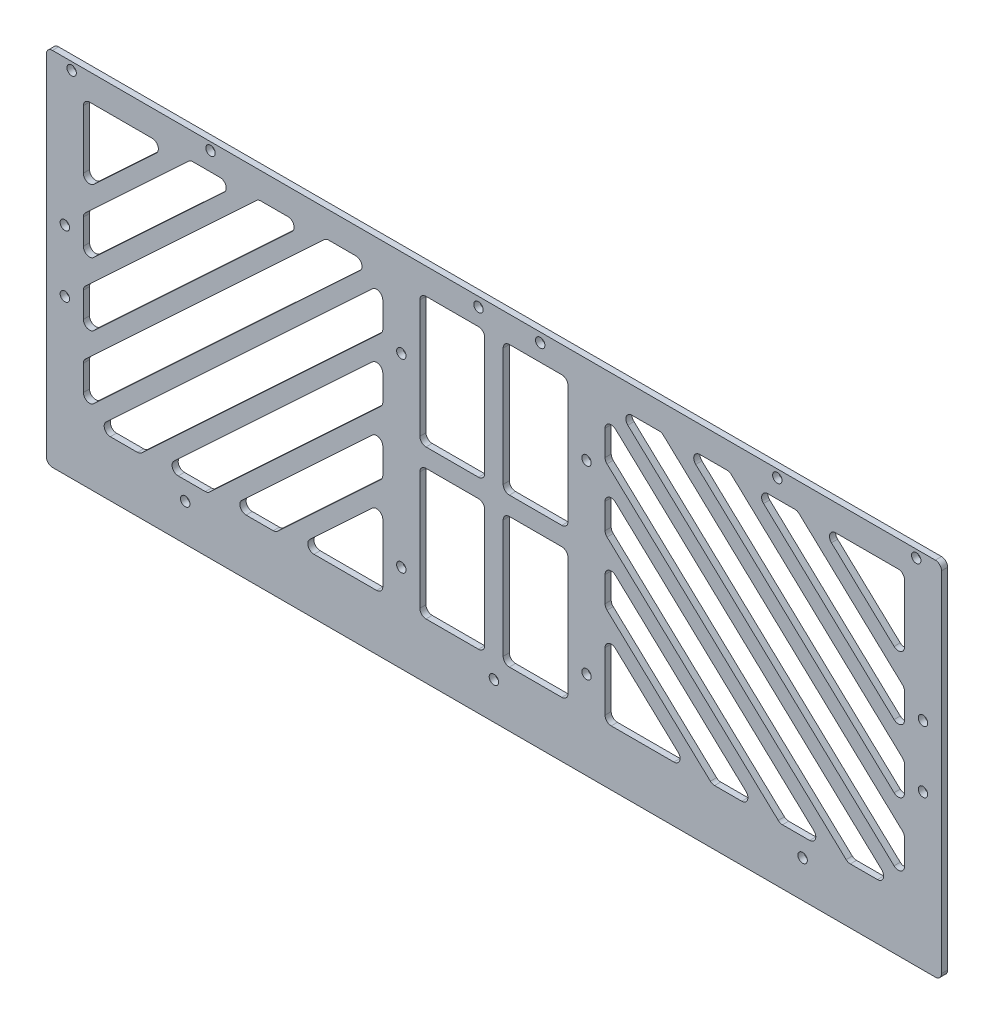
from build123d import *

# Parameters (mm, degrees)
SKETCH_1_W          = 290
SKETCH_1_H          = 117
EXTRUDE_1_DEPTH     = 1
SKETCH_2_R          = 1.525
CUT_EXTRUDE_1_DEPTH = 10
SKETCH_3_R          = 1.525
CUT_EXTRUDE_2_DEPTH = 10
SKETCH_4_R          = 1.525
CUT_EXTRUDE_3_DEPTH = 10
FILLET_1_R          = 2
SKETCH_5_R          = 1.525
CUT_EXTRUDE_4_DEPTH = 10
SKETCH_6_R          = 1.525
CUT_EXTRUDE_5_DEPTH = 10
CUT_EXTRUDE_6_DEPTH = 10
SKETCH_8_W          = 21
SKETCH_8_H          = 42.25
CUT_EXTRUDE_7_DEPTH = 10
FILLET_2_R          = 2


with BuildPart() as part:
    # 草图1 → 凸台-拉伸1 (new, symmetric)
    with BuildSketch(Plane.XY):
        Rectangle(SKETCH_1_W, SKETCH_1_H)
    extrude(amount=EXTRUDE_1_DEPTH, both=True)

    # 草图2 → 切除-拉伸1 (cut)
    with BuildSketch(Plane.XY.offset(1)):
        with Locations((91.8, 56)):
            Circle(SKETCH_2_R)
        with Locations((136.8, 56)):
            Circle(SKETCH_2_R)
    cut_extrude_1 = extrude(amount=-CUT_EXTRUDE_1_DEPTH, mode=Mode.SUBTRACT)

    # 镜向1: 切除-拉伸1 across plane
    add(cut_extrude_1.mirror(Plane(origin=(0, 0, 0), x_dir=(0, 0, 1), z_dir=(1, 0, 0))), mode=Mode.SUBTRACT)

    # 草图3 → 切除-拉伸2 (cut)
    with BuildSketch(Plane.XY.offset(1)):
        with Locations((-100, -46.5)):
            Circle(SKETCH_3_R)
        with Locations((0, -46.5)):
            Circle(SKETCH_3_R)
        with Locations((100, -46.5)):
            Circle(SKETCH_3_R)
    extrude(amount=-CUT_EXTRUDE_2_DEPTH, mode=Mode.SUBTRACT)

    # 草图4 → 切除-拉伸3 (cut)
    with BuildSketch(Plane.XY.offset(1)):
        with Locations((-139, 11.5)):
            Circle(SKETCH_4_R)
        with Locations((-139, -8.5)):
            Circle(SKETCH_4_R)
    cut_extrude_3 = extrude(amount=-CUT_EXTRUDE_3_DEPTH, mode=Mode.SUBTRACT)

    # 镜向2: 切除-拉伸3 across plane
    add(cut_extrude_3.mirror(Plane(origin=(0, 0, 0), x_dir=(0, 0, 1), z_dir=(1, 0, 0))), mode=Mode.SUBTRACT)

    # 圆角1
    fillet_1_edges = [part.edges().sort_by_distance(p)[0] for p in [
        (145, -58.5, 0),
        (-145, -58.5, 0),
        (-145, 58.5, 0),
        (145, 58.5, 0),
    ]]
    fillet(fillet_1_edges, radius=FILLET_1_R)

    # 草图5 → 切除-拉伸4 (cut)
    with BuildSketch(Plane.XY.offset(1)):
        with Locations((-5, 55.5)):
            Circle(SKETCH_5_R)
        with Locations((15, 55.5)):
            Circle(SKETCH_5_R)
    extrude(amount=-CUT_EXTRUDE_4_DEPTH, mode=Mode.SUBTRACT)

    # 草图6 → 切除-拉伸5 (cut)
    with BuildSketch(Plane.XY.offset(1)):
        with Locations((-30, 30)):
            Circle(SKETCH_6_R)
        with Locations((-30, -30)):
            Circle(SKETCH_6_R)
        with Locations((30, -30)):
            Circle(SKETCH_6_R)
        with Locations((30, 30)):
            Circle(SKETCH_6_R)
    extrude(amount=-CUT_EXTRUDE_5_DEPTH, mode=Mode.SUBTRACT)

    # 草图7 → 切除-拉伸6 (cut)
    with BuildSketch(Plane.XY.offset(1)):
        Polygon((-105.629313077, 50), (-133, 50), (-133, 24.463431273), align=None)
        Polygon((-83.641108947, 50), (-98.299911701, 50), (-133, 17.625175349), (-133, 3.948663503), align=None)
        Polygon((-61.652904818, 50), (-76.311707571, 50), (-133, -2.889592421), (-133, -16.566104268), align=None)
        Polygon((-39.664700688, 50), (-54.323503441, 50), (-133, -23.404360191), (-133, -37.080872038), align=None)
        Polygon((-36, 32.904360191), (-36, 46.580872038), (-129.335299312, -40.5), (-114.676496559, -40.5), align=None)
        Polygon((-36, 12.389592421), (-36, 26.066104268), (-107.347095182, -40.5), (-92.688292429, -40.5), align=None)
        Polygon((-36, -8.125175349), (-36, 5.551336497), (-85.358891053, -40.5), (-70.700088299, -40.5), align=None)
        Polygon((-36, -14.963431273), (-63.370686923, -40.5), (-36, -40.5), align=None)
        Polygon((133, 50), (105.629313077, 50), (133, 24.463431273), align=None)
        Polygon((133, 17.625175349), (98.299911701, 50), (83.641108947, 50), (133, 3.948663503), align=None)
        Polygon((133, -2.889592421), (76.311707571, 50), (61.652904818, 50), (133, -16.566104268), align=None)
        Polygon((133, -23.404360191), (54.323503441, 50), (39.664700688, 50), (133, -37.080872038), align=None)
        Polygon((129.335299312, -40.5), (36, 46.580872038), (36, 32.904360191), (114.676496559, -40.5), align=None)
        Polygon((107.347095182, -40.5), (36, 26.066104268), (36, 12.389592421), (92.688292429, -40.5), align=None)
        Polygon((85.358891053, -40.5), (36, 5.551336497), (36, -8.125175349), (70.700088299, -40.5), align=None)
        Polygon((63.370686923, -40.5), (36, -14.963431273), (36, -40.5), align=None)
    extrude(amount=-CUT_EXTRUDE_6_DEPTH, mode=Mode.SUBTRACT)

    # 草图8 → 切除-拉伸7 (cut)
    with BuildSketch(Plane.XY.offset(1)):
        with Locations((-13.5, -19.375)):
            Rectangle(SKETCH_8_W, SKETCH_8_H)
        with Locations((13.5, -19.375)):
            Rectangle(SKETCH_8_W, SKETCH_8_H)
        with Locations((13.5, 28.875)):
            Rectangle(SKETCH_8_W, SKETCH_8_H)
        with Locations((-13.5, 28.875)):
            Rectangle(SKETCH_8_W, SKETCH_8_H)
    extrude(amount=-CUT_EXTRUDE_7_DEPTH, mode=Mode.SUBTRACT)

    # 圆角2
    fillet_2_edges = [part.edges().sort_by_distance(p)[0] for p in [
        (-98.299911701, 50, 0),
        (-83.641108947, 50, 0),
        (-133, 3.948663503, 0),
        (-133, 17.625175349, 0),
        (-76.311707571, 50, 0),
        (-61.652904818, 50, 0),
        (-133, -16.566104268, 0),
        (-133, -2.889592421, 0),
        (-105.629313077, 50, 0),
        (-133, 24.463431273, 0),
        (-133, 50, 0),
        (63.370686923, -40.5, 0),
        (36, -40.5, 0),
        (36, -14.963431273, 0),
        (-36, 26.066104268, 0),
        (-36, 12.389592421, 0),
        (-92.688292429, -40.5, 0),
        (-107.347095182, -40.5, 0),
        (-36, 5.551336497, 0),
        (-36, -8.125175349, 0),
        (-70.700088299, -40.5, 0),
        (-85.358891053, -40.5, 0),
        (-54.323503441, 50, 0),
        (-39.664700688, 50, 0),
        (-133, -37.080872038, 0),
        (-133, -23.404360191, 0),
        (-36, 32.904360191, 0),
        (-114.676496559, -40.5, 0),
        (-129.335299312, -40.5, 0),
        (-36, 46.580872038, 0),
        (98.299911701, 50, 0),
        (133, 17.625175349, 0),
        (133, 3.948663503, 0),
        (83.641108947, 50, 0),
        (76.311707571, 50, 0),
        (133, -2.889592421, 0),
        (133, -16.566104268, 0),
        (61.652904818, 50, 0),
        (133, 50, 0),
        (133, 24.463431273, 0),
        (105.629313077, 50, 0),
        (107.347095182, -40.5, 0),
        (92.688292429, -40.5, 0),
        (36, 12.389592421, 0),
        (36, 26.066104268, 0),
        (85.358891053, -40.5, 0),
        (70.700088299, -40.5, 0),
        (36, -8.125175349, 0),
        (36, 5.551336497, 0),
        (54.323503441, 50, 0),
        (133, -23.404360191, 0),
        (133, -37.080872038, 0),
        (39.664700688, 50, 0),
        (129.335299312, -40.5, 0),
        (114.676496559, -40.5, 0),
        (36, 32.904360191, 0),
        (36, 46.580872038, 0),
        (-36, -14.963431273, 0),
        (-36, -40.5, 0),
        (-63.370686923, -40.5, 0),
        (-24, 7.75, 0),
        (-24, 50, 0),
        (-3, 50, 0),
        (-3, 7.75, 0),
        (3, 7.75, 0),
        (3, 50, 0),
        (24, 50, 0),
        (24, 7.75, 0),
        (3, 1.75, 0),
        (24, 1.75, 0),
        (24, -40.5, 0),
        (3, -40.5, 0),
        (-24, 1.75, 0),
        (-3, 1.75, 0),
        (-3, -40.5, 0),
        (-24, -40.5, 0),
    ]]
    fillet(fillet_2_edges, radius=FILLET_2_R)


solid = part.part
